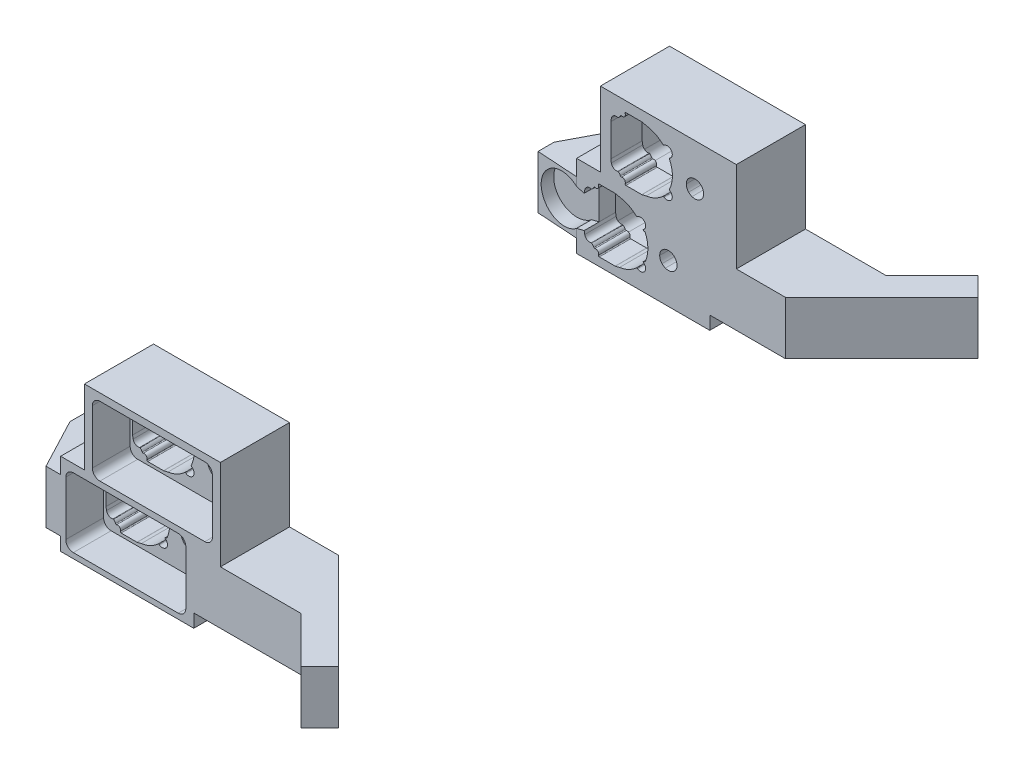
from build123d import *

# Parameters (mm, degrees)
BOSS_EXTRUDE1_DEPTH      = 25.4
BOSS_EXTRUDE2_DEPTH      = 6.35
BOSS_EXTRUDE2_DEPTH_BACK = 68.58
SKETCH6_W                = 99.695
SKETCH6_H                = 33.02
CUT_EXTRUDE2_START       = -33.02
CUT_EXTRUDE2_DEPTH       = 18.034
SKETCH3_R                = 11.1125
CUT_EXTRUDE3_DEPTH       = 7.1628
CUT_EXTRUDE4_REACH       = 178.155
CUT_EXTRUDE5_START       = -12.446
SKETCH5_4_R              = 6.113994518
CUT_EXTRUDE5_DEPTH       = 2.54
CUT_EXTRUDE6_DEPTH       = 7.1628
CUT_EXTRUDE7_REACH       = 178.155
SKETCH8_W                = 23.42
SKETCH8_H                = 43.18
SKETCH8_W_2              = 11.355
SKETCH8_H_2              = 35.57
SKETCH8_W_3              = 36.12
SKETCH8_H_3              = 6.35


with BuildPart() as part:
    # Sketch2 → Boss-Extrude1 (new body)
    with BuildSketch(Plane(origin=(0, 0, 0), x_dir=(1, 0, 0), z_dir=(0, 1, 0))):
        Polygon((152.664354058, -152.664354058), (106.68, -106.68), (6.985, -106.68), (-12.7, -107.95), (-12.7, -115.57), (0, -139.7), (121.739487758, -139.7), (143.684097937, -161.644610179), align=None)
    extrude(amount=BOSS_EXTRUDE1_DEPTH)

    # Sketch6 → Boss-Extrude2 (add, two sides: drawn at the far end of the back side and taken through both)
    with BuildSketch(Plane.XZ.offset(-BOSS_EXTRUDE2_DEPTH_BACK)):
        with Locations((56.8325, 123.19)):
            Rectangle(SKETCH6_W, SKETCH6_H)
    extrude(amount=BOSS_EXTRUDE2_DEPTH + BOSS_EXTRUDE2_DEPTH_BACK)

    # Sketch5 → Cut-Extrude2 (cut)
    with BuildSketch(Plane(origin=(0, 0, 106.68), x_dir=(-1, 0, 0), z_dir=(0, 0, -1)).offset(CUT_EXTRUDE2_START)):
        with BuildLine():
            Line((-66.75, 25.6), (-66.75, -0.2))
            ThreePointArc((-66.75, -0.2), (-65.695584412, -2.745584412), (-63.15, -3.8))
            Line((-63.15, -3.8), (-13.05, -3.8))
            ThreePointArc((-13.05, -3.8), (-10.504415588, -2.745584412), (-9.45, -0.2))
            Line((-9.45, -0.2), (-9.45, 25.6))
            ThreePointArc((-9.45, 25.6), (-10.504415588, 28.145584412), (-13.05, 29.2))
            Line((-13.05, 29.2), (-63.15, 29.2))
            ThreePointArc((-63.15, 29.2), (-65.695584412, 28.145584412), (-66.75, 25.6))
        make_face()
        with BuildLine():
            Line((-79.45, 61.521024484), (-79.45, 35.721024484))
            ThreePointArc((-79.45, 35.721024484), (-78.395584412, 33.175440072), (-75.85, 32.121024484))
            Line((-75.85, 32.121024484), (-25.75, 32.121024484))
            ThreePointArc((-25.75, 32.121024484), (-23.204415588, 33.175440072), (-22.15, 35.721024484))
            Line((-22.15, 35.721024484), (-22.15, 61.521024484))
            ThreePointArc((-22.15, 61.521024484), (-23.204415588, 64.066608897), (-25.75, 65.121024484))
            Line((-25.75, 65.121024484), (-75.85, 65.121024484))
            ThreePointArc((-75.85, 65.121024484), (-78.395584412, 64.066608897), (-79.45, 61.521024484))
        make_face()
    extrude(amount=CUT_EXTRUDE2_DEPTH, mode=Mode.SUBTRACT)

    # Sketch3 → Cut-Extrude3 (cut)
    with BuildSketch(Plane(origin=(0, 0, 106.68), x_dir=(-1, 0, 0), z_dir=(0, 0, -1))):
        with Locations((0, 12.7)):
            Circle(SKETCH3_R)
    extrude(amount=-CUT_EXTRUDE3_DEPTH, mode=Mode.SUBTRACT)

    # Sketch5<3> → Cut-Extrude4 (cut, up to next)
    with BuildSketch(Plane(origin=(0, 0, 106.68), x_dir=(-1, 0, 0), z_dir=(0, 0, -1)), mode=Mode.PRIVATE) as cut_extrude4_sk1:
        with BuildLine():
            ThreePointArc((-17.454544234, 27.201392579), (-17.161089301, 25.735153586), (-15.710183504, 25.37342862))
            add(Edge.make_bspline(
                [(-15.214362493, 25.145843703), (-15.252740591, 25.239203063), (-15.326706684, 25.315665227), (-15.50838897, 25.398999551), (-15.614372286, 25.405194234), (-15.710183504, 25.37342862)],
                knots=[0, 0, 0, 0, 0.000301952, 0.000301952, 0.000603904, 0.000603904, 0.000603904, 0.000603904], degree=3, weights=[1, 1, 1, 1, 1, 1]))
            ThreePointArc((-15.214362493, 25.145843703), (-14.792159607, 24.439786176), (-14.181363394, 23.888695899))
            add(Edge.make_bspline(
                [(-13.93307766, 23.850380907), (-14.016819693, 23.826397587), (-14.108747024, 23.840583645), (-14.181363394, 23.888695899)],
                knots=[0, 0, 0, 0, 0.000257617, 0.000257617, 0.000257617, 0.000257617], degree=3, weights=[1, 1, 1, 1]))
            ThreePointArc((-13.93307766, 23.850380907), (-11.978075507, 23.575139467), (-10.874203161, 21.938295824))
            Line((-10.874203161, 21.938295824), (-10.611201717, 20.446740514))
            ThreePointArc((-10.611201717, 20.446740514), (-10.606647112, 20.412144857), (-10.60512505, 20.377283888))
            Line((-10.60512505, 20.377283888), (-10.60512505, 5.022716112))
            ThreePointArc((-10.60512505, 5.022716112), (-10.606647112, 4.987855143), (-10.611201717, 4.953259486))
            Line((-10.611201717, 4.953259486), (-10.874203161, 3.461704176))
            ThreePointArc((-10.874203161, 3.461704176), (-11.978075507, 1.824860533), (-13.93307766, 1.549619093))
            add(Edge.make_bspline(
                [(-14.181363394, 1.511304101), (-14.108747016, 1.55941636), (-14.016819684, 1.573602411), (-13.93307766, 1.549619093)],
                knots=[0, 0, 0, 0, 0.000257617, 0.000257617, 0.000257617, 0.000257617], degree=3, weights=[1, 1, 1, 1]))
            ThreePointArc((-14.181363394, 1.511304101), (-14.792159607, 0.960213824), (-15.214362493, 0.254156297))
            add(Edge.make_bspline(
                [(-15.710183504, 0.02657138), (-15.614372263, -0.005194241), (-15.508171677, 0.001041216), (-15.326534106, 0.084472958), (-15.252740582, 0.16079696), (-15.214362493, 0.254156297)],
                knots=[0, 0, 0, 0, 0.000301952, 0.000301952, 0.000603904, 0.000603904, 0.000603904, 0.000603904], degree=3, weights=[1, 1, 1, 1, 1, 1]))
            ThreePointArc((-15.710183504, 0.02657138), (-17.161089301, -0.335153586), (-17.454544234, -1.801392579))
            add(Edge.make_bspline(
                [(-17.827902311, -2.34487495), (-17.697556499, -2.34487495), (-17.571268418, -2.277913043), (-17.424786106, -2.064315845), (-17.407781693, -1.923061319), (-17.454544234, -1.801392579)],
                knots=[0, 0, 0, 0, 0.000387965, 0.000387965, 0.00077593, 0.00077593, 0.00077593, 0.00077593], degree=3, weights=[1, 1, 1, 1, 1, 1]))
            Line((-17.827902311, -2.34487495), (-25.391814589, -2.34487495))
            ThreePointArc((-25.391814589, -2.34487495), (-25.436649043, -2.342354252), (-25.480918405, -2.334823926))
            Line((-25.480918405, -2.334823926), (-27.45939141, -1.882722774))
            ThreePointArc((-27.45939141, -1.882722774), (-31.807672398, -0.560415941), (-35.545722635, 2.024738472))
            add(Edge.make_bspline(
                [(-35.92871369, 2.049985751), (-35.871983492, 2.091202652), (-35.802580884, 2.111197617), (-35.663081434, 2.102085507), (-35.596551285, 2.073045802), (-35.545722635, 2.024738472)],
                knots=[0, 0, 0, 0, 0.000207381, 0.000207381, 0.000414763, 0.000414763, 0.000414763, 0.000414763], degree=3, weights=[1, 1, 1, 1, 1, 1]))
            Line((-35.92871369, 2.049985751), (-36.108453306, 1.919397276))
            ThreePointArc((-36.108453306, 1.919397276), (-39.499078855, 2.456419606), (-38.962056525, 5.847045155))
            Line((-38.962056525, 5.847045155), (-38.700039494, 6.037411672))
            add(Edge.make_bspline(
                [(-39.671321079, 6.40912486), (-39.491482985, 6.470326051), (-39.295863933, 6.466518129), (-38.942049513, 6.33134656), (-38.793068952, 6.20304034), (-38.700039494, 6.037411672)],
                knots=[0, 0, 0, 0, 0.000207192, 0.000207192, 0.000414384, 0.000414384, 0.000414384, 0.000414384], degree=3, weights=[1, 1, 1, 1, 1, 1]))
            ThreePointArc((-39.671321079, 6.40912486), (-40.996336601, 12.7), (-39.671321079, 18.99087514))
            add(Edge.make_bspline(
                [(-38.700039494, 19.362588328), (-38.793068939, 19.196959683), (-38.941249019, 19.069194359), (-39.294906836, 18.933613589), (-39.49148296, 18.92967394), (-39.671321079, 18.99087514)],
                knots=[0, 0, 0, 0, 0.000207192, 0.000207192, 0.000414384, 0.000414384, 0.000414384, 0.000414384], degree=3, weights=[1, 1, 1, 1, 1, 1]))
            Line((-38.700039494, 19.362588328), (-38.962056525, 19.552954845))
            ThreePointArc((-38.962056525, 19.552954845), (-39.499078855, 22.943580394), (-36.108453306, 23.480602724))
            Line((-36.108453306, 23.480602724), (-35.92871369, 23.350014249))
            add(Edge.make_bspline(
                [(-35.545722635, 23.375261528), (-35.596551277, 23.326954205), (-35.662728517, 23.298021636), (-35.802216956, 23.288742494), (-35.871983484, 23.308797342), (-35.92871369, 23.350014249)],
                knots=[0, 0, 0, 0, 0.000207381, 0.000207381, 0.000414763, 0.000414763, 0.000414763, 0.000414763], degree=3, weights=[1, 1, 1, 1, 1, 1]))
            ThreePointArc((-35.545722635, 23.375261528), (-31.807672398, 25.960415941), (-27.45939141, 27.282722774))
            Line((-27.45939141, 27.282722774), (-25.480918405, 27.734823926))
            ThreePointArc((-25.480918405, 27.734823926), (-25.436649043, 27.742354252), (-25.391814589, 27.74487495))
            Line((-25.391814589, 27.74487495), (-17.827902311, 27.74487495))
            add(Edge.make_bspline(
                [(-17.454544234, 27.201392579), (-17.407781675, 27.323061366), (-17.42497916, 27.46496564), (-17.571805697, 27.678326365), (-17.697556549, 27.74487495), (-17.827902311, 27.74487495)],
                knots=[0, 0, 0, 0, 0.000387965, 0.000387965, 0.00077593, 0.00077593, 0.00077593, 0.00077593], degree=3, weights=[1, 1, 1, 1, 1, 1]))
        make_face()
    cut_extrude4_tool1 = extrude(cut_extrude4_sk1.sketch, amount=-CUT_EXTRUDE4_REACH, mode=Mode.PRIVATE) & part.part
    # Sketch5<3> → Cut-Extrude4 (cut, up to next)
    with BuildSketch(Plane(origin=(0, 0, 106.68), x_dir=(-1, 0, 0), z_dir=(0, 0, -1)), mode=Mode.PRIVATE) as cut_extrude4_sk2:
        with BuildLine():
            add(Edge.make_bspline(
                [(-60.481955136, 45.780504886), (-60.43603869, 45.830492059), (-60.342768327, 45.932031316), (-60.210512218, 46.095686675), (-60.082424784, 46.270790705), (-59.960384175, 46.458160464), (-59.845452755, 46.657637292), (-59.738984645, 46.869213959), (-59.621767894, 47.140289076), (-59.508614587, 47.470465843), (-59.417629172, 47.856630085), (-59.362280095, 48.240348368), (-59.355545496, 48.495193602), (-59.35222026, 48.621024484)],
                knots=[0, 0, 0, 0, 0.065342869, 0.132731377, 0.202172121, 0.273671089, 0.34723372, 0.422864961, 0.500569311, 0.630039386, 0.756419003, 0.879730881, 1, 1, 1, 1], degree=3))
            add(Edge.make_bspline(
                [(-59.35222026, 48.621024484), (-59.353041537, 48.683605666), (-59.354694528, 48.809563278), (-59.368182489, 48.999289729), (-59.390076129, 49.190570817), (-59.421452131, 49.382952948), (-59.462353225, 49.575954803), (-59.513076509, 49.769063285), (-59.573817711, 49.961751282), (-59.66958434, 50.22044963), (-59.812379165, 50.532057472), (-60.01548274, 50.878047648), (-60.236777354, 51.188660597), (-60.401680377, 51.372198075), (-60.481955136, 51.461544083)],
                knots=[0, 0, 0, 0, 0.059829934, 0.120420154, 0.181774032, 0.243894787, 0.306785488, 0.370449065, 0.434888311, 0.500105888, 0.634537507, 0.762645389, 0.884455823, 1, 1, 1, 1], degree=3))
            add(Edge.make_bspline(
                [(-60.481955136, 51.461544083), (-60.530159757, 51.511097927), (-60.62469657, 51.608280778), (-60.772553471, 51.74244675), (-60.919998795, 51.864970253), (-61.066676585, 51.975832923), (-61.256721871, 52.107106274), (-61.493288336, 52.249506944), (-61.777918239, 52.393732819), (-61.971154552, 52.469744688), (-62.065454672, 52.506838795)],
                knots=[0, 0, 0, 0, 0.108779889, 0.213334401, 0.313672693, 0.409804769, 0.501741655, 0.675682941, 0.841731935, 1, 1, 1, 1], degree=3))
            ThreePointArc((-62.065454672, 52.506838795), (-67.642158031, 48.621024484), (-62.065454672, 44.735210174))
            add(Edge.make_bspline(
                [(-62.065454672, 44.735210174), (-62.008979836, 44.756870749), (-61.894345595, 44.800838005), (-61.723848207, 44.877399324), (-61.551983288, 44.963484129), (-61.379725849, 45.060307764), (-61.182854283, 45.183635126), (-60.961270581, 45.342187281), (-60.715668653, 45.544576476), (-60.561593799, 45.70011149), (-60.481955136, 45.780504886)],
                knots=[0, 0, 0, 0, 0.094498647, 0.191816063, 0.291978629, 0.395010761, 0.500935114, 0.655694233, 0.822034222, 1, 1, 1, 1], degree=3))
        make_face()
    cut_extrude4_tool2 = extrude(cut_extrude4_sk2.sketch, amount=-CUT_EXTRUDE4_REACH, mode=Mode.PRIVATE) & part.part
    # Sketch5<3> → Cut-Extrude4 (cut, up to next)
    with BuildSketch(Plane(origin=(0, 0, 106.68), x_dir=(-1, 0, 0), z_dir=(0, 0, -1)), mode=Mode.PRIVATE) as cut_extrude4_sk3:
        with BuildLine():
            ThreePointArc((-30.154544234, 63.122417063), (-29.861089301, 61.65617807), (-28.410183504, 61.294453104))
            add(Edge.make_bspline(
                [(-27.914362493, 61.066868187), (-27.952740591, 61.160227547), (-28.026706684, 61.236689711), (-28.20838897, 61.320024036), (-28.314372286, 61.326218718), (-28.410183504, 61.294453104)],
                knots=[0, 0, 0, 0, 0.000301952, 0.000301952, 0.000603904, 0.000603904, 0.000603904, 0.000603904], degree=3, weights=[1, 1, 1, 1, 1, 1]))
            ThreePointArc((-27.914362493, 61.066868187), (-27.492159607, 60.36081066), (-26.881363394, 59.809720383))
            add(Edge.make_bspline(
                [(-26.63307766, 59.771405392), (-26.716819693, 59.747422071), (-26.808747024, 59.761608129), (-26.881363394, 59.809720383)],
                knots=[0, 0, 0, 0, 0.000257617, 0.000257617, 0.000257617, 0.000257617], degree=3, weights=[1, 1, 1, 1]))
            ThreePointArc((-26.63307766, 59.771405392), (-24.678075507, 59.496163951), (-23.574203161, 57.859320308))
            Line((-23.574203161, 57.859320308), (-23.311201717, 56.367764998))
            ThreePointArc((-23.311201717, 56.367764998), (-23.306647112, 56.333169342), (-23.30512505, 56.298308372))
            Line((-23.30512505, 56.298308372), (-23.30512505, 40.943740596))
            ThreePointArc((-23.30512505, 40.943740596), (-23.306647112, 40.908879627), (-23.311201717, 40.87428397))
            Line((-23.311201717, 40.87428397), (-23.574203161, 39.38272866))
            ThreePointArc((-23.574203161, 39.38272866), (-24.678075507, 37.745885017), (-26.63307766, 37.470643577))
            add(Edge.make_bspline(
                [(-26.881363394, 37.432328586), (-26.808747016, 37.480440845), (-26.716819684, 37.494626895), (-26.63307766, 37.470643577)],
                knots=[0, 0, 0, 0, 0.000257617, 0.000257617, 0.000257617, 0.000257617], degree=3, weights=[1, 1, 1, 1]))
            ThreePointArc((-26.881363394, 37.432328586), (-27.492159607, 36.881238309), (-27.914362493, 36.175180781))
            add(Edge.make_bspline(
                [(-28.410183504, 35.947595864), (-28.314372263, 35.915830243), (-28.208171677, 35.922065701), (-28.026534106, 36.005497443), (-27.952740582, 36.081821444), (-27.914362493, 36.175180781)],
                knots=[0, 0, 0, 0, 0.000301952, 0.000301952, 0.000603904, 0.000603904, 0.000603904, 0.000603904], degree=3, weights=[1, 1, 1, 1, 1, 1]))
            ThreePointArc((-28.410183504, 35.947595864), (-29.861089301, 35.585870898), (-30.154544234, 34.119631905))
            add(Edge.make_bspline(
                [(-30.527902311, 33.576149534), (-30.397556499, 33.576149534), (-30.271268418, 33.643111441), (-30.124786106, 33.856708639), (-30.107781693, 33.997963165), (-30.154544234, 34.119631905)],
                knots=[0, 0, 0, 0, 0.000387965, 0.000387965, 0.00077593, 0.00077593, 0.00077593, 0.00077593], degree=3, weights=[1, 1, 1, 1, 1, 1]))
            Line((-30.527902311, 33.576149534), (-38.091814589, 33.576149534))
            ThreePointArc((-38.091814589, 33.576149534), (-38.136649043, 33.578670232), (-38.180918405, 33.586200558))
            Line((-38.180918405, 33.586200558), (-40.15939141, 34.03830171))
            ThreePointArc((-40.15939141, 34.03830171), (-44.507672398, 35.360608544), (-48.245722635, 37.945762956))
            add(Edge.make_bspline(
                [(-48.62871369, 37.971010235), (-48.571983492, 38.012227136), (-48.502580884, 38.032222102), (-48.363081434, 38.023109992), (-48.296551285, 37.994070286), (-48.245722635, 37.945762956)],
                knots=[0, 0, 0, 0, 0.000207381, 0.000207381, 0.000414763, 0.000414763, 0.000414763, 0.000414763], degree=3, weights=[1, 1, 1, 1, 1, 1]))
            Line((-48.62871369, 37.971010235), (-48.808453306, 37.84042176))
            ThreePointArc((-48.808453306, 37.84042176), (-52.199078855, 38.37744409), (-51.662056525, 41.76806964))
            Line((-51.662056525, 41.76806964), (-51.400039494, 41.958436156))
            add(Edge.make_bspline(
                [(-51.305540598, 42.330149344), (-51.275410324, 42.26690114), (-51.268415461, 42.195084423), (-51.302753207, 42.059688347), (-51.343361112, 41.999615411), (-51.400039494, 41.958436156)],
                knots=[0, 0, 0, 0, 0.000207192, 0.000207192, 0.000414384, 0.000414384, 0.000414384, 0.000414384], degree=3, weights=[1, 1, 1, 1, 1, 1]))
            ThreePointArc((-51.305540598, 42.330149344), (-52.727419885, 48.621024484), (-51.305540598, 54.911899624))
            add(Edge.make_bspline(
                [(-51.400039494, 55.283612813), (-51.343361119, 55.242433563), (-51.302917009, 55.182677033), (-51.268422661, 55.04732077), (-51.275410319, 54.975147837), (-51.305540598, 54.911899624)],
                knots=[0, 0, 0, 0, 0.000207192, 0.000207192, 0.000414384, 0.000414384, 0.000414384, 0.000414384], degree=3, weights=[1, 1, 1, 1, 1, 1]))
            Line((-51.400039494, 55.283612813), (-51.662056525, 55.473979329))
            ThreePointArc((-51.662056525, 55.473979329), (-52.199078855, 58.864604878), (-48.808453306, 59.401627208))
            Line((-48.808453306, 59.401627208), (-48.62871369, 59.271038734))
            add(Edge.make_bspline(
                [(-48.245722635, 59.296286012), (-48.296551277, 59.24797869), (-48.362728517, 59.21904612), (-48.502216956, 59.209766979), (-48.571983484, 59.229821826), (-48.62871369, 59.271038734)],
                knots=[0, 0, 0, 0, 0.000207381, 0.000207381, 0.000414763, 0.000414763, 0.000414763, 0.000414763], degree=3, weights=[1, 1, 1, 1, 1, 1]))
            ThreePointArc((-48.245722635, 59.296286012), (-44.507672398, 61.881440425), (-40.15939141, 63.203747258))
            Line((-40.15939141, 63.203747258), (-38.180918405, 63.65584841))
            ThreePointArc((-38.180918405, 63.65584841), (-38.136649043, 63.663378736), (-38.091814589, 63.665899435))
            Line((-38.091814589, 63.665899435), (-30.527902311, 63.665899435))
            add(Edge.make_bspline(
                [(-30.154544234, 63.122417063), (-30.107781675, 63.24408585), (-30.12497916, 63.385990124), (-30.271805697, 63.599350849), (-30.397556549, 63.665899435), (-30.527902311, 63.665899435)],
                knots=[0, 0, 0, 0, 0.000387965, 0.000387965, 0.00077593, 0.00077593, 0.00077593, 0.00077593], degree=3, weights=[1, 1, 1, 1, 1, 1]))
        make_face()
    cut_extrude4_tool3 = extrude(cut_extrude4_sk3.sketch, amount=-CUT_EXTRUDE4_REACH, mode=Mode.PRIVATE) & part.part
    # Sketch5<3> → Cut-Extrude4 (cut, up to next)
    with BuildSketch(Plane(origin=(0, 0, 106.68), x_dir=(-1, 0, 0), z_dir=(0, 0, -1)), mode=Mode.PRIVATE) as cut_extrude4_sk4:
        with BuildLine():
            ThreePointArc((-49.365454672, 16.58581431), (-54.942158031, 12.7), (-49.365454672, 8.81418569))
            add(Edge.make_bspline(
                [(-49.365454672, 8.81418569), (-49.308979836, 8.835846265), (-49.194345595, 8.879813521), (-49.023848207, 8.95637484), (-48.851983288, 9.042459645), (-48.679725849, 9.13928328), (-48.482854283, 9.262610642), (-48.261270581, 9.421162797), (-48.015668653, 9.623551991), (-47.861593799, 9.779087006), (-47.781955136, 9.859480401)],
                knots=[0, 0, 0, 0, 0.094498647, 0.191816063, 0.291978629, 0.395010761, 0.500935114, 0.655694233, 0.822034222, 1, 1, 1, 1], degree=3))
            add(Edge.make_bspline(
                [(-47.781955136, 9.859480401), (-47.73603869, 9.909467575), (-47.642768327, 10.011006832), (-47.510512218, 10.174662191), (-47.382424784, 10.34976622), (-47.260384175, 10.53713598), (-47.145452755, 10.736612808), (-47.038984645, 10.948189474), (-46.921767894, 11.219264592), (-46.808614587, 11.549441358), (-46.717629172, 11.935605601), (-46.662280095, 12.319323884), (-46.655545496, 12.574169118), (-46.65222026, 12.7)],
                knots=[0, 0, 0, 0, 0.065342869, 0.132731377, 0.202172121, 0.273671089, 0.34723372, 0.422864961, 0.500569311, 0.630039386, 0.756419003, 0.879730881, 1, 1, 1, 1], degree=3))
            add(Edge.make_bspline(
                [(-46.65222026, 12.7), (-46.653041537, 12.762581182), (-46.654694528, 12.888538793), (-46.668182489, 13.078265245), (-46.690076129, 13.269546333), (-46.721452131, 13.461928463), (-46.762353225, 13.654930319), (-46.813076509, 13.848038801), (-46.873817711, 14.040726798), (-46.96958434, 14.299425146), (-47.112379165, 14.611032988), (-47.31548274, 14.957023164), (-47.536777354, 15.267636113), (-47.701680377, 15.451173591), (-47.781955136, 15.540519599)],
                knots=[0, 0, 0, 0, 0.059829934, 0.120420154, 0.181774032, 0.243894787, 0.306785488, 0.370449065, 0.434888311, 0.500105888, 0.634537507, 0.762645389, 0.884455823, 1, 1, 1, 1], degree=3))
            add(Edge.make_bspline(
                [(-47.781955136, 15.540519599), (-47.830159757, 15.590073443), (-47.92469657, 15.687256294), (-48.072553471, 15.821422265), (-48.219998795, 15.943945769), (-48.366676585, 16.054808438), (-48.556721871, 16.18608179), (-48.793288336, 16.32848246), (-49.077918239, 16.472708334), (-49.271154552, 16.548720204), (-49.365454672, 16.58581431)],
                knots=[0, 0, 0, 0, 0.108779889, 0.213334401, 0.313672693, 0.409804769, 0.501741655, 0.675682941, 0.841731935, 1, 1, 1, 1], degree=3))
        make_face()
    cut_extrude4_tool4 = extrude(cut_extrude4_sk4.sketch, amount=-CUT_EXTRUDE4_REACH, mode=Mode.PRIVATE) & part.part
    add(cut_extrude4_tool1.solids().sort_by_distance((25.222191, 12.699997, 106.68))[0], mode=Mode.SUBTRACT)
    add(cut_extrude4_tool2.solids().sort_by_distance((63.497895, 48.621015, 106.68))[0], mode=Mode.SUBTRACT)
    add(cut_extrude4_tool3.solids().sort_by_distance((37.673429, 48.621023, 106.68))[0], mode=Mode.SUBTRACT)
    add(cut_extrude4_tool4.solids().sort_by_distance((50.797895, 12.69999, 106.68))[0], mode=Mode.SUBTRACT)

    # Sketch5<4> → Cut-Extrude5 (cut)
    # profile 1 of 2: a face of its own
    with BuildSketch(Plane(origin=(0, 0, 106.68), x_dir=(-1, 0, 0), z_dir=(0, 0, -1)).offset(CUT_EXTRUDE5_START)):
        with Locations((-52.4, 12.7)):
            Circle(SKETCH5_4_R)
        with BuildLine():
            add(Edge.make_bspline(
                [(-46.65222026, 12.7), (-46.653041537, 12.762581182), (-46.654694528, 12.888538793), (-46.668182489, 13.078265245), (-46.690076129, 13.269546333), (-46.721452131, 13.461928463), (-46.762353225, 13.654930319), (-46.813076509, 13.848038801), (-46.873817711, 14.040726798), (-46.96958434, 14.299425146), (-47.112379165, 14.611032988), (-47.31548274, 14.957023164), (-47.536777354, 15.267636113), (-47.701680377, 15.451173591), (-47.781955136, 15.540519599)],
                knots=[0, 0, 0, 0, 0.059829934, 0.120420154, 0.181774032, 0.243894787, 0.306785488, 0.370449065, 0.434888311, 0.500105888, 0.634537507, 0.762645389, 0.884455823, 1, 1, 1, 1], degree=3))
            add(Edge.make_bspline(
                [(-47.781955136, 15.540519599), (-47.830159757, 15.590073443), (-47.92469657, 15.687256294), (-48.072553471, 15.821422265), (-48.219998795, 15.943945769), (-48.366676585, 16.054808438), (-48.556721871, 16.18608179), (-48.793288336, 16.32848246), (-49.077918239, 16.472708334), (-49.271154552, 16.548720204), (-49.365454672, 16.58581431)],
                knots=[0, 0, 0, 0, 0.108779889, 0.213334401, 0.313672693, 0.409804769, 0.501741655, 0.675682941, 0.841731935, 1, 1, 1, 1], degree=3))
            ThreePointArc((-49.365454672, 16.58581431), (-54.942158031, 12.7), (-49.365454672, 8.81418569))
            add(Edge.make_bspline(
                [(-49.365454672, 8.81418569), (-49.308979836, 8.835846265), (-49.194345595, 8.879813521), (-49.023848207, 8.95637484), (-48.851983288, 9.042459645), (-48.679725849, 9.13928328), (-48.482854283, 9.262610642), (-48.261270581, 9.421162797), (-48.015668653, 9.623551991), (-47.861593799, 9.779087006), (-47.781955136, 9.859480401)],
                knots=[0, 0, 0, 0, 0.094498647, 0.191816063, 0.291978629, 0.395010761, 0.500935114, 0.655694233, 0.822034222, 1, 1, 1, 1], degree=3))
            add(Edge.make_bspline(
                [(-47.781955136, 9.859480401), (-47.73603869, 9.909467575), (-47.642768327, 10.011006832), (-47.510512218, 10.174662191), (-47.382424784, 10.34976622), (-47.260384175, 10.53713598), (-47.145452755, 10.736612808), (-47.038984645, 10.948189474), (-46.921767894, 11.219264592), (-46.808614587, 11.549441358), (-46.717629172, 11.935605601), (-46.662280095, 12.319323884), (-46.655545496, 12.574169118), (-46.65222026, 12.7)],
                knots=[0, 0, 0, 0, 0.065342869, 0.132731377, 0.202172121, 0.273671089, 0.34723372, 0.422864961, 0.500569311, 0.630039386, 0.756419003, 0.879730881, 1, 1, 1, 1], degree=3))
        make_face(mode=Mode.SUBTRACT)
    # profile 2 of 2: a face of its own
    with BuildSketch(Plane(origin=(0, 0, 106.68), x_dir=(-1, 0, 0), z_dir=(0, 0, -1)).offset(CUT_EXTRUDE5_START)):
        with Locations((-65.1, 48.621024484)):
            Circle(SKETCH5_4_R)
    extrude(amount=-CUT_EXTRUDE5_DEPTH, mode=Mode.SUBTRACT)

    # Sketch7 → Cut-Extrude6 (cut)
    with BuildSketch(Plane(origin=(0, 0, 106.68), x_dir=(-1, 0, 0), z_dir=(0, 0, -1))):
        Polygon((-6.985, 21.342767569), (-10.60512505, 20.377283888), (-10.60512505, 16.019484739), align=None)
        Polygon((-6.985, 4.057232431), (-10.611201717, 4.953259486), (-10.60512505, 9.380515261), align=None)
    extrude(amount=-CUT_EXTRUDE6_DEPTH, mode=Mode.SUBTRACT)

    # Sketch8 → Cut-Extrude7 (cut, up to next)
    with BuildSketch(Plane(origin=(0, 0, 106.68), x_dir=(-1, 0, 0), z_dir=(0, 0, -1)), mode=Mode.PRIVATE) as cut_extrude7_sk1:
        with Locations((-94.97, 46.99)):
            Rectangle(SKETCH8_W, SKETCH8_H)
    cut_extrude7_tool1 = extrude(cut_extrude7_sk1.sketch, amount=-CUT_EXTRUDE7_REACH, mode=Mode.PRIVATE) & part.part
    # Sketch8 → Cut-Extrude7 (cut, up to next)
    with BuildSketch(Plane(origin=(0, 0, 106.68), x_dir=(-1, 0, 0), z_dir=(0, 0, -1)), mode=Mode.PRIVATE) as cut_extrude7_sk2:
        with Locations((-12.6625, 50.795)):
            Rectangle(SKETCH8_W_2, SKETCH8_H_2)
    cut_extrude7_tool2 = extrude(cut_extrude7_sk2.sketch, amount=-CUT_EXTRUDE7_REACH, mode=Mode.PRIVATE) & part.part
    # Sketch8 → Cut-Extrude7 (cut, up to next)
    with BuildSketch(Plane(origin=(0, 0, 106.68), x_dir=(-1, 0, 0), z_dir=(0, 0, -1)), mode=Mode.PRIVATE) as cut_extrude7_sk3:
        with Locations((-88.62, -3.175)):
            Rectangle(SKETCH8_W_3, SKETCH8_H_3)
    cut_extrude7_tool3 = extrude(cut_extrude7_sk3.sketch, amount=-CUT_EXTRUDE7_REACH, mode=Mode.PRIVATE) & part.part
    add(cut_extrude7_tool1.solids().sort_by_distance((94.97, 46.99, 106.68))[0], mode=Mode.SUBTRACT)
    add(cut_extrude7_tool2.solids().sort_by_distance((12.6625, 50.795, 106.68))[0], mode=Mode.SUBTRACT)
    add(cut_extrude7_tool3.solids().sort_by_distance((88.62, -3.175, 106.68))[0], mode=Mode.SUBTRACT)


with BuildPart() as body_2:
    # Mirror2: mirrored copy
    add(part.part.mirror(Plane.XY))


solid = Compound([part.part, body_2.part])
